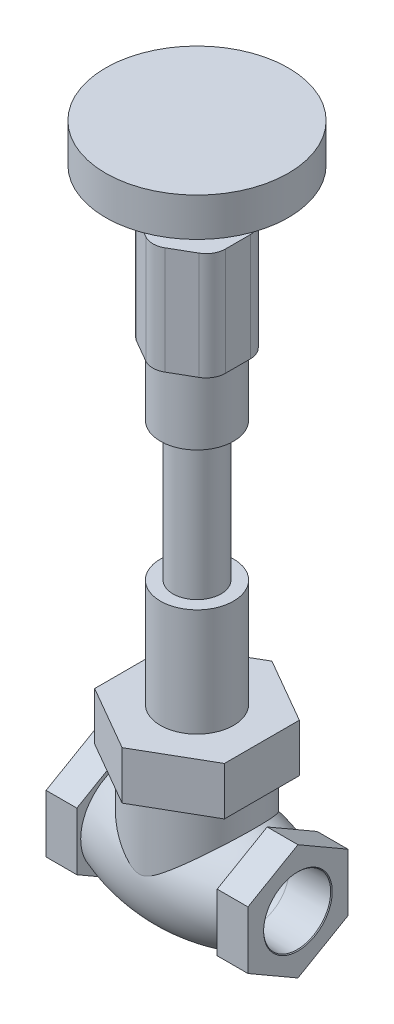
from build123d import *

# Parameters (mm, degrees)
CUT_EXTRUDE1_DEPTH      = 186.884048489
CUT_EXTRUDE1_DEPTH_BACK = 186.884048489
SKETCH3_R               = 10.668
SKETCH4_R               = 11.0900667
BOSS_EXTRUDE1_DEPTH     = 10.16
BOSS_EXTRUDE2_DEPTH     = 15.875
SKETCH9_R               = 4.2545
BOSS_EXTRUDE4_DEPTH     = 35.56


with BuildPart() as part:
    # Sketch1 → Revolve1 (revolve)
    with BuildSketch(Plane.XY, mode=Mode.PRIVATE) as revolve1_sk:
        with BuildLine():
            Line((-33.3375, 11.0900667), (-19.78152, 10.668))
            Line((-19.78152, 10.668), (19.78152, 10.668))
            Line((19.78152, 10.668), (33.3375, 11.0900667))
            Line((33.3375, 11.0900667), (33.3375, 16.51))
            Line((33.3375, 16.51), (23.1775, 16.51))
            Line((23.1775, 16.51), (23.1775, 15.24))
            ThreePointArc((23.1775, 15.24), (0, 19.3675), (-23.1775, 15.24))
            Line((-23.1775, 15.24), (-23.1775, 16.51))
            Line((-23.1775, 16.51), (-33.3375, 16.51))
            Line((-33.3375, 16.51), (-33.3375, 11.0900667))
        make_face()
    revolve(revolve1_sk.sketch.rotate(Axis((-33.3375, 0, 0), (1, 0, 0)), 90), axis=Axis((-33.3375, 0, 0), (1, 0, 0)))

    # Sketch2 → Revolve2 (revolve)
    with BuildSketch(Plane.XY, mode=Mode.PRIVATE) as revolve2_sk:
        Polygon((0, 0), (0, 168.91), (4.2545, 168.91), (4.2545, 181.61), (13.49375, 181.61), (13.49375, 146.05), (12.065, 146.05), (12.065, 123.825), (7.9375, 123.825), (7.9375, 78.105), (12.065, 78.105), (12.065, 42.545), (21.43125, 42.545), (21.43125, 26.67), (19.05, 26.67), (19.05, 0), align=None)
    revolve(revolve2_sk.sketch.rotate(Axis((0, 0, 0), (0, -1, 0)), 90), axis=Axis((0, 0, 0), (0, -1, 0)))

    # Sketch3 → Cut-Extrude1 (cut, two sides: drawn at the far end of the back side and taken through both)
    with BuildSketch(Plane(origin=(0, 0, 0), x_dir=(0, 0, -1), z_dir=(1, 0, 0)).offset(-CUT_EXTRUDE1_DEPTH_BACK)):
        with Locations(Location((0, 0, 0), (0, 0, 180))):
            Circle(SKETCH3_R)
    extrude(amount=CUT_EXTRUDE1_DEPTH + CUT_EXTRUDE1_DEPTH_BACK, mode=Mode.SUBTRACT)

    # Sketch4 → Boss-Extrude1 (add)
    with BuildSketch(Plane.ZY.offset(33.3375)):
        Polygon((0, 19.064105889), (-16.51, 9.532052944), (-16.51, -9.532052944), (0, -19.064105889), (16.51, -9.532052944), (16.51, 9.532052944), align=None)
        Circle(SKETCH4_R, mode=Mode.SUBTRACT)
    boss_extrude1 = extrude(amount=-BOSS_EXTRUDE1_DEPTH)

    # Cut-Extrude3 cone 1 section (through the dimple's axis) → Cut-Extrude3 (revolve, cut)
    with BuildSketch(Plane(origin=(-33.3375, 0, 0), x_dir=(0, 0, 1), z_dir=(0, 1, 0))):
        Polygon((0, 0), (11.3440667, 0), (0, 11.3440667), align=None)
    cut_extrude3 = revolve(axis=Axis((-33.3375, 0, 0), (1, 0, 0)), mode=Mode.SUBTRACT)

    # Mirror1: Boss-Extrude1, Cut-Extrude3 across plane
    add(boss_extrude1.mirror(Plane(origin=(0, 0, 0), x_dir=(0, 0, 1), z_dir=(1, 0, 0))))
    add(cut_extrude3.mirror(Plane(origin=(0, 0, 0), x_dir=(0, 0, 1), z_dir=(1, 0, 0))), mode=Mode.SUBTRACT)

    # Sketch8 → Boss-Extrude2 (add)
    with BuildSketch(Plane(origin=(0, 42.545, 0), x_dir=(1, 0, 0), z_dir=(0, 1, 0))):
        Polygon((0, -24.746675913), (21.43125, -12.373337957), (21.43125, 12.373337957), (0, 24.746675913), (-21.43125, 12.373337957), (-21.43125, -12.373337957), align=None)
    extrude(amount=-BOSS_EXTRUDE2_DEPTH)

    # Sketch9 → Boss-Extrude4 (add)
    with BuildSketch(Plane(origin=(0, 181.61, -183.515), x_dir=(1, 0, 0), z_dir=(0, -1, 0))):
        with BuildLine():
            Line((-3.175, 197.263153285), (-10.31875, 193.1387073))
            ThreePointArc((-10.31875, 193.1387073), (-12.643011314, 190.814445986), (-13.49375, 187.639445986))
            Line((-13.49375, 187.639445986), (-13.49375, 179.390554014))
            ThreePointArc((-13.49375, 179.390554014), (-12.643011314, 176.215554014), (-10.31875, 173.8912927))
            Line((-10.31875, 173.8912927), (-3.175, 169.766846715))
            ThreePointArc((-3.175, 169.766846715), (0, 168.916108029), (3.175, 169.766846715))
            Line((3.175, 169.766846715), (10.31875, 173.8912927))
            ThreePointArc((10.31875, 173.8912927), (12.643011314, 176.215554014), (13.49375, 179.390554014))
            Line((13.49375, 179.390554014), (13.49375, 187.639445986))
            ThreePointArc((13.49375, 187.639445986), (12.643011314, 190.814445986), (10.31875, 193.1387073))
            Line((10.31875, 193.1387073), (3.175, 197.263153285))
            ThreePointArc((3.175, 197.263153285), (0, 198.113891971), (-3.175, 197.263153285))
        make_face()
        with Locations(Location((0, 183.515, 0), (0, 0, 90))):
            Circle(SKETCH9_R, mode=Mode.SUBTRACT)
    extrude(amount=BOSS_EXTRUDE4_DEPTH)


with BuildPart() as body_2:
    # Sketch11 → Revolve4 (revolve)
    with BuildSketch(Plane.XY, mode=Mode.PRIVATE) as revolve4_sk:
        Polygon((0, 168.91), (0, 209.55), (-30.1625, 209.55), (-30.1625, 196.85), (-7.9375, 196.85), (-7.9375, 190.5), (-4.2545, 190.5), (-4.2545, 168.91), align=None)
    revolve(revolve4_sk.sketch.rotate(Axis((0, 168.91, 0), (0, -1, 0)), 270), axis=Axis((0, 168.91, 0), (0, -1, 0)))


solid = Compound([part.part, body_2.part])
